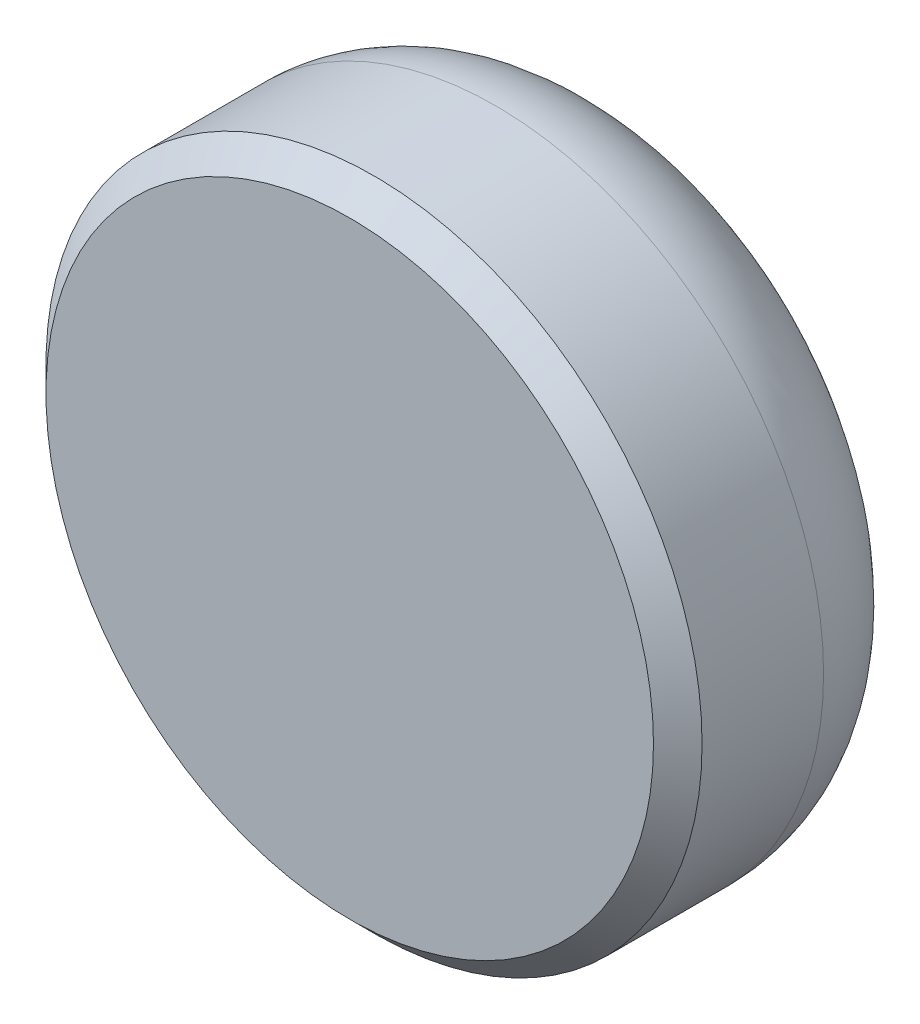
from build123d import *

# Parameters (mm, degrees)
SKETCH_1_R      = 2.7
EXTRUDE_1_DEPTH = 2.2
FILLET_1_R      = 1
CHAMFER_1_SIZE  = 0.2


with BuildPart() as part:
    # 草图1 → 凸台-拉伸1 (new body)
    with BuildSketch(Plane.XY):
        Circle(SKETCH_1_R)
    extrude(amount=EXTRUDE_1_DEPTH)

    # 圆角1
    fillet_1_edges = [part.edges().sort_by_distance(p)[0] for p in [
        (-2.7, 0, 0),
    ]]
    fillet(fillet_1_edges, radius=FILLET_1_R)

    # 倒角1
    chamfer_1_edges = [part.edges().sort_by_distance(p)[0] for p in [
        (-2.7, 0, 2.2),
    ]]
    chamfer(chamfer_1_edges, length=CHAMFER_1_SIZE)


solid = part.part
